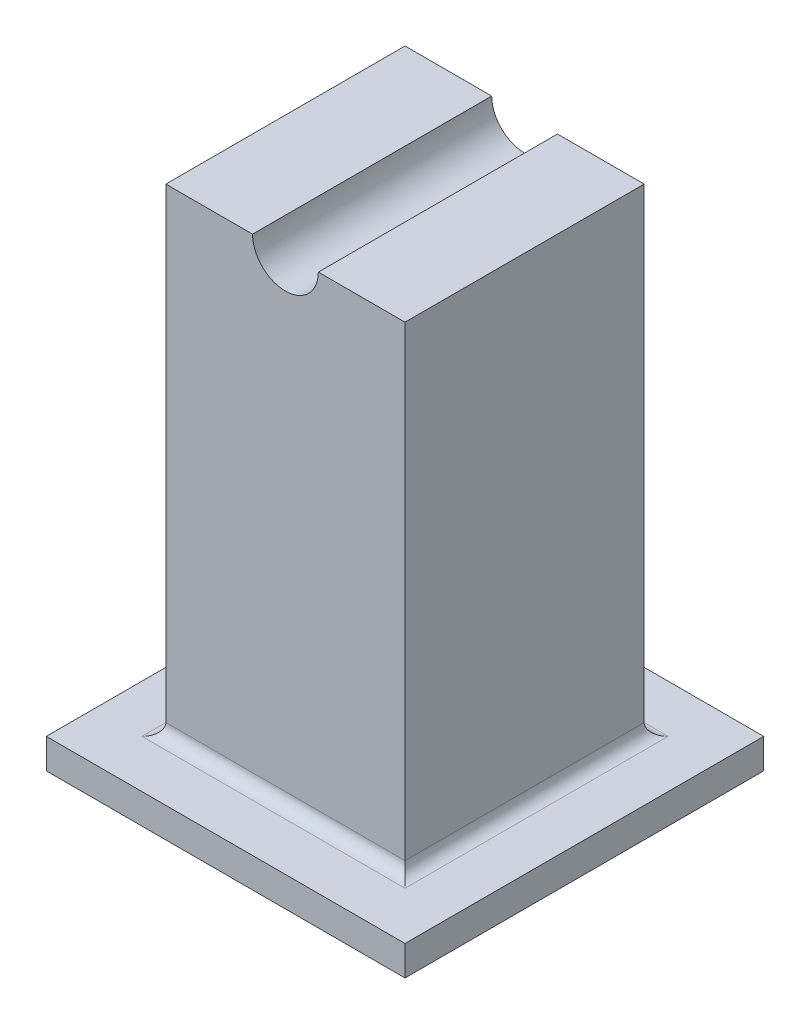
from build123d import *

# Parameters (mm, degrees)
BOSS_EXTRUDE1_DEPTH = 50.8
SKETCH2_W           = 38.1
SKETCH2_H           = 38.1
CUT_EXTRUDE1_DEPTH  = 95.25
SKETCH3_W           = 76.2
SKETCH3_H           = 76.2
SKETCH3_W_2         = 50.8
SKETCH3_H_2         = 50.8
BOSS_EXTRUDE2_DEPTH = 6.35
FILLET1_R           = 2.54


with BuildPart() as part:
    # Sketch1 → Boss-Extrude1 (new body)
    with BuildSketch(Plane.XY):
        with BuildLine():
            Line((32.385, 107.95), (50.8, 107.95))
            Line((50.8, 107.95), (50.8, 0))
            Line((50.8, 0), (0, 0))
            Line((0, 0), (0, 107.95))
            Line((0, 107.95), (18.415, 107.95))
            ThreePointArc((18.415, 107.95), (25.4, 100.965), (32.385, 107.95))
        make_face()
    extrude(amount=BOSS_EXTRUDE1_DEPTH)

    # Sketch2 → Cut-Extrude1 (cut)
    with BuildSketch(Plane.XZ):
        with Locations((25.4, 25.4)):
            Rectangle(SKETCH2_W, SKETCH2_H)
    extrude(amount=-CUT_EXTRUDE1_DEPTH, mode=Mode.SUBTRACT)

    # Sketch3 → Boss-Extrude2 (add)
    with BuildSketch(Plane.XZ):
        with Locations((25.4, 25.4)):
            Rectangle(SKETCH3_W, SKETCH3_H)
        with Locations((25.4, 25.4)):
            Rectangle(SKETCH3_W_2, SKETCH3_H_2, mode=Mode.SUBTRACT)
    extrude(amount=-BOSS_EXTRUDE2_DEPTH)

    # Fillet1
    fillet1_edges = [part.edges().sort_by_distance(p)[0] for p in [
        (50.8, 6.35, 25.4),
        (25.4, 6.35, 50.8),
        (0, 6.35, 25.4),
        (25.4, 6.35, 0),
    ]]
    fillet(fillet1_edges, radius=FILLET1_R)


solid = part.part
